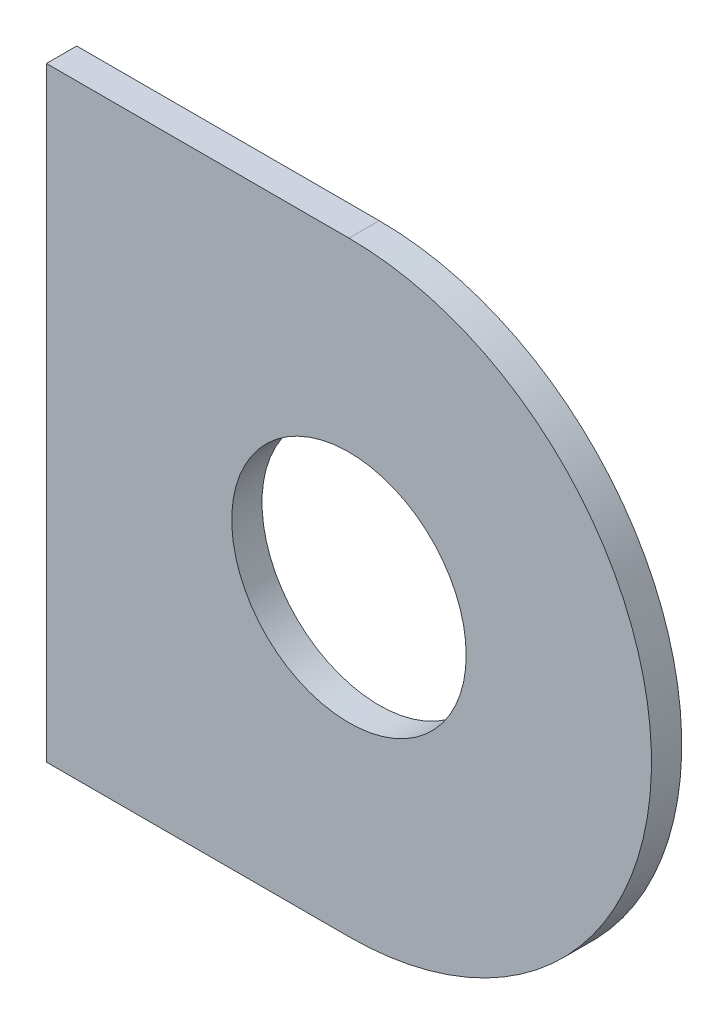
from build123d import *

# Parameters (mm, degrees)
ESQUISSE1_R        = 7.75
BOSS_EXTRU_1_DEPTH = 2


with BuildPart() as part:
    # Esquisse1 → Boss.-Extru.1 (new body)
    with BuildSketch(Plane.XY):
        with BuildLine():
            Line((0, 0), (20, 0))
            ThreePointArc((20, 0), (40, 20), (20, 40))
            Line((20, 40), (0, 40))
            Line((0, 40), (0, 0))
        make_face()
        with Locations((20, 20)):
            Circle(ESQUISSE1_R, mode=Mode.SUBTRACT)
    extrude(amount=BOSS_EXTRU_1_DEPTH)


solid = part.part
